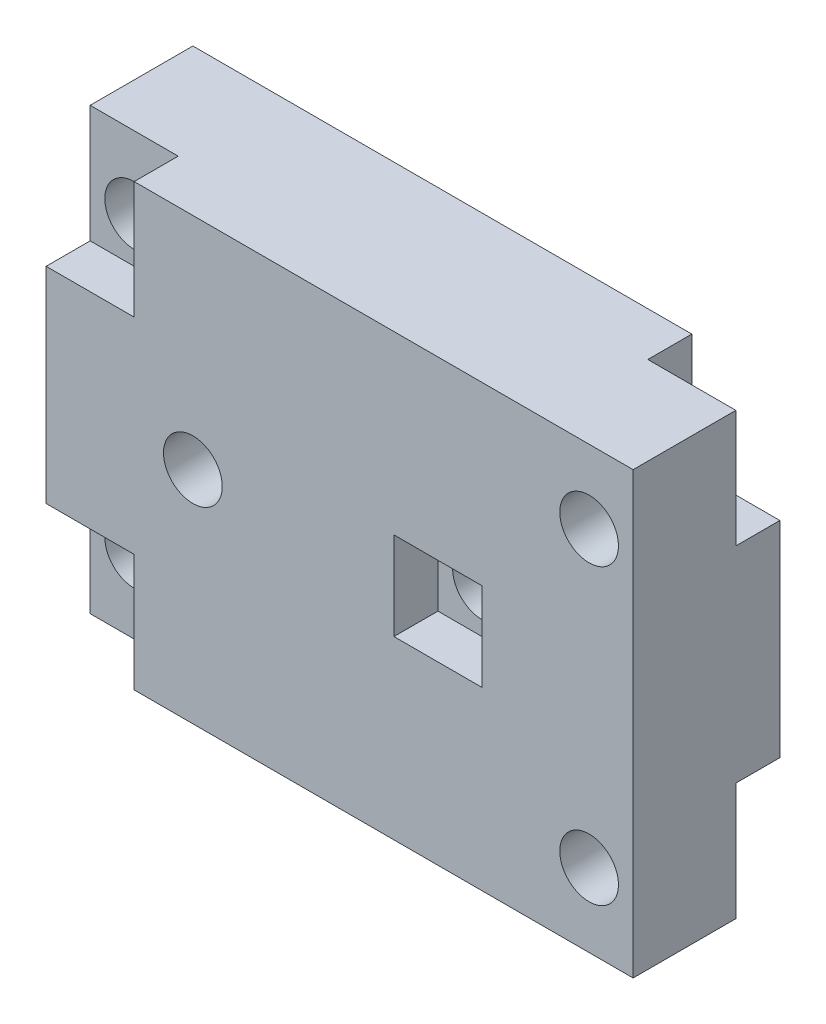
from build123d import *
from build123d.topology import SkipClean

# Parameters (mm, degrees)
SKETCH_1_W          = 40
SKETCH_1_H          = 30
EXTRUDE_1_DEPTH     = 5
SKETCH_2_R          = 2
CUT_EXTRUDE_1_DEPTH = 5
SKETCH_3_R          = 3
CUT_EXTRUDE_2_DEPTH = 2.5
SKETCH_5_W          = 40
SKETCH_5_H          = 30
SKETCH_5_R          = 2
EXTRUDE_2_DEPTH     = 3
SKETCH_3_2_R        = 3
CUT_EXTRUDE_3_DEPTH = 3
SKETCH_9_W          = 40
SKETCH_9_H          = 30
SKETCH_9_R          = 2
EXTRUDE_4_DEPTH     = 2
SKETCH_8_R          = 2
CUT_EXTRUDE_5_DEPTH = 10
CUT_EXTRUDE_START   = 10
SKETCH_8_4_R        = 2
CUT_EXTRUDE_6_DEPTH = 10
CUT_EXTRUDE_7_DEPTH = 3
CUT_EXTRUDE_8_DEPTH = 3


with BuildPart() as part:
    # 草图1 → 凸台-拉伸1 (new body)
    with BuildSketch(Plane.XY):
        with Locations((20, 15)):
            Rectangle(SKETCH_1_W, SKETCH_1_H)
    extrude(amount=EXTRUDE_1_DEPTH)

    # 草图2 → 切除-拉伸1 (cut)
    with BuildSketch(Plane.XY.offset(5)):
        with Locations((3, 25)):
            Circle(SKETCH_2_R)
        with Locations((3, 5)):
            Circle(SKETCH_2_R)
        with Locations((26.7, 15)):
            Circle(SKETCH_2_R)
    extrude(amount=-CUT_EXTRUDE_1_DEPTH, mode=Mode.SUBTRACT)

    # 草图3 → 切除-拉伸2 (cut)
    with BuildSketch(Plane.XY.offset(5)):
        with Locations((26.7, 15)):
            Circle(SKETCH_3_R)
        Polygon((3, 22), (6, 22), (6, 30), (0, 30), (0, 22), align=None)
        Polygon((3, 8), (0, 8), (0, 0), (6, 0), (6, 8), align=None)
    extrude(amount=-CUT_EXTRUDE_2_DEPTH, mode=Mode.SUBTRACT)

    # 草图5 → 凸台-拉伸2 (add)
    with SkipClean():  # the faces are left unmerged after this step: merging them gives an invalid solid
        with BuildSketch(Plane(origin=(0, 0, 0), x_dir=(-1, 0, 0), z_dir=(0, 0, -1))):
            with Locations((-20, 15)):
                Rectangle(SKETCH_5_W, SKETCH_5_H)
            with Locations((-26.7, 15)):
                Circle(SKETCH_5_R, mode=Mode.SUBTRACT)
            with Locations((-3, 25)):
                Circle(SKETCH_5_R, mode=Mode.SUBTRACT)
            with Locations((-3, 5)):
                Circle(SKETCH_5_R, mode=Mode.SUBTRACT)
        extrude(amount=EXTRUDE_2_DEPTH)

    # 草图3<2> → 切除-拉伸3 (cut)
    with SkipClean():  # the faces are left unmerged after this step: merging them gives an invalid solid
        with BuildSketch(Plane.XY.offset(5)):
            with Locations((26.7, 15)):
                Circle(SKETCH_3_2_R)
            Polygon((3, 22), (6, 22), (6, 30), (0, 30), (0, 22), align=None)
            Polygon((3, 8), (0, 8), (0, 0), (6, 0), (6, 8), align=None)
        extrude(amount=-CUT_EXTRUDE_3_DEPTH, mode=Mode.SUBTRACT)

    # 草图9 → 凸台-拉伸4 (add)
    with SkipClean():  # the faces are left unmerged after this step: merging them gives an invalid solid
        with BuildSketch(Plane(origin=(0, 0, -3), x_dir=(-1, 0, 0), z_dir=(0, 0, -1))):
            with Locations((-20, 15)):
                Rectangle(SKETCH_9_W, SKETCH_9_H)
            with Locations((-3, 5)):
                Circle(SKETCH_9_R, mode=Mode.SUBTRACT)
            with Locations((-26.7, 15)):
                Circle(SKETCH_9_R, mode=Mode.SUBTRACT)
            with Locations((-3, 25)):
                Circle(SKETCH_9_R, mode=Mode.SUBTRACT)
        extrude(amount=EXTRUDE_4_DEPTH)

    # 草图8 → 切除-拉伸5 (cut)
    with SkipClean():  # the faces are left unmerged after this step: merging them gives an invalid solid
        with BuildSketch(Plane(origin=(0, 0, -3), x_dir=(-1, 0, 0), z_dir=(0, 0, -1))):
            with Locations((-37, 25)):
                Circle(SKETCH_8_R)
            with Locations((-37, 5)):
                Circle(SKETCH_8_R)
            with Locations((-10, 15)):
                Circle(SKETCH_8_R)
        extrude(amount=-CUT_EXTRUDE_5_DEPTH, mode=Mode.SUBTRACT)

    # 草图8<4> → 切除-拉伸6 (cut)
    with SkipClean():  # the faces are left unmerged after this step: merging them gives an invalid solid
        with BuildSketch(Plane(origin=(0, 0, -3), x_dir=(-1, 0, 0), z_dir=(0, 0, -1)).offset(CUT_EXTRUDE_START)):
            with Locations((-37, 25)):
                Circle(SKETCH_8_4_R)
            with Locations((-37, 5)):
                Circle(SKETCH_8_4_R)
            with Locations((-10, 15)):
                Circle(SKETCH_8_4_R)
        extrude(amount=-CUT_EXTRUDE_6_DEPTH, mode=Mode.SUBTRACT)

    # 草图11 → 切除-拉伸7 (cut)
    with SkipClean():  # the faces are left unmerged after this step: merging them gives an invalid solid
        with BuildSketch(Plane(origin=(0, 0, -5), x_dir=(-1, 0, 0), z_dir=(0, 0, -1))):
            Polygon((-37, 22), (-40, 22), (-40, 30), (-34, 30), (-34, 22), align=None)
            Polygon((-37, 8), (-40, 8), (-40, 0), (-34, 0), (-34, 8), align=None)
            Polygon((-10, 18), (-7, 18), (-7, 12), (-13, 12), (-13, 18), align=None)
        extrude(amount=-CUT_EXTRUDE_7_DEPTH, mode=Mode.SUBTRACT)

    # 草图12 → 切除-拉伸8 (cut)
    with SkipClean():  # the faces are left unmerged after this step: merging them gives an invalid solid
        with BuildSketch(Plane.XY.offset(5)):
            Polygon((26.7, 18), (29.7, 18), (29.7, 12), (23.7, 12), (23.7, 18), align=None)
        extrude(amount=-CUT_EXTRUDE_8_DEPTH, mode=Mode.SUBTRACT)


solid = part.part
